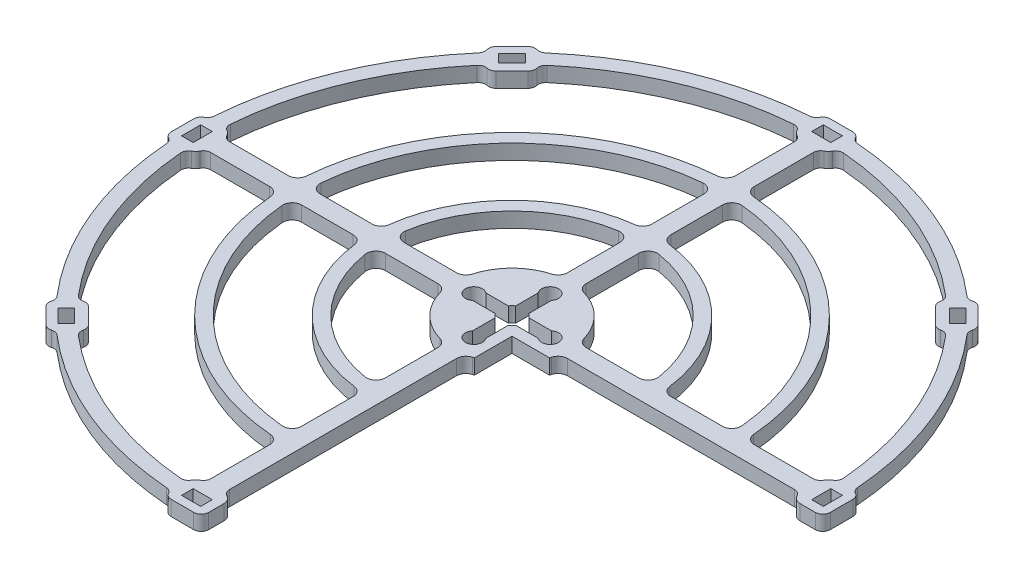
from build123d import *

# Parameters (mm, degrees)
SKETCH1_R             = 15.5
BOSS_EXTRUDE1_DEPTH   = 4
BOSS_EXTRUDE1_2_DEPTH = 4
BOSS_EXTRUDE1_3_DEPTH = 4
BOSS_EXTRUDE1_4_DEPTH = 4
BOSS_EXTRUDE2_DEPTH   = 4
CUT_EXTRUDE1_DEPTH    = 4
BOSS_EXTRUDE5_DEPTH   = 4
SKETCH5_W             = 5.1
SKETCH5_H             = 3.1
SKETCH5_W_2           = 3.1
SKETCH5_H_2           = 5.1
CUT_EXTRUDE3_DEPTH    = 125.309437393
SKETCH6_W             = 10.00423668
SKETCH6_H             = 10.00423668
CUT_EXTRUDE4_DEPTH    = 125.309437393
FILLET1_R             = 2.5
FILLET2_R             = 2


with BuildPart() as part:
    # Sketch1 → Boss-Extrude1 (new body)
    with BuildSketch(Plane(origin=(0, 0, 0), x_dir=(1, 0, 0), z_dir=(0, 1, 0))):
        with Locations(Location((0, 0, 0), (0, 0, 270))):
            Circle(SKETCH1_R)
    extrude(amount=BOSS_EXTRUDE1_DEPTH)



with BuildPart() as body_2:
    # Sketch1 → Boss-Extrude1 2 (new body)
    with BuildSketch(Plane(origin=(0, 0, 0), x_dir=(1, 0, 0), z_dir=(0, 1, 0))):
        with BuildLine():
            Line((2.5, -56.27783262), (2.5, -59.781082106))
            ThreePointArc((2.5, -59.781082106), (-42.308555741, 42.308555741), (59.781082106, -2.5))
            Line((59.781082106, -2.5), (56.27783262, -2.5))
            ThreePointArc((56.27783262, -2.5), (-39.833682007, 39.833682007), (2.5, -56.27783262))
        make_face()
    extrude(amount=BOSS_EXTRUDE1_2_DEPTH)


with BuildPart() as body_3:
    # Sketch1 → Boss-Extrude1 3 (new body)
    with BuildSketch(Plane(origin=(0, 0, 0), x_dir=(1, 0, 0), z_dir=(0, 1, 0))):
        with BuildLine():
            Line((2.5, -34.0750805), (2.5, -37.583610494))
            ThreePointArc((2.5, -37.583610494), (-26.634355425, 26.634355425), (37.583610494, -2.5))
            Line((37.583610494, -2.5), (34.0750805, -2.5))
            ThreePointArc((34.0750805, -2.5), (-24.159481691, 24.159481691), (2.5, -34.0750805))
        make_face()
    extrude(amount=BOSS_EXTRUDE1_3_DEPTH)


with BuildPart() as body_4:
    # Sketch1 → Boss-Extrude1 4 (new body)
    with BuildSketch(Plane(origin=(0, 0, 0), x_dir=(1, 0, 0), z_dir=(0, 1, 0))):
        with BuildLine():
            Line((2.5, -81.961881384), (2.5, -85.963655111))
            ThreePointArc((2.5, -85.963655111), (-60.811183182, 60.811183182), (85.963655111, -2.5))
            Line((85.963655111, -2.5), (81.961881384, -2.5))
            ThreePointArc((81.961881384, -2.5), (-57.982756057, 57.982756057), (2.5, -81.961881384))
        make_face()
    extrude(amount=BOSS_EXTRUDE1_4_DEPTH)


with BuildPart() as part_1:
    add(part.part)

    add(body_2.part)  # Boss-Extrude2 merges body 2

    add(body_3.part)  # Boss-Extrude2 merges body 3

    add(body_4.part)  # Boss-Extrude2 merges body 4
    # Sketch2 → Boss-Extrude2 (add)
    with BuildSketch(Plane(origin=(0, 4, 0), x_dir=(1, 0, 0), z_dir=(0, 1, 0))):
        with BuildLine():
            Line((-2.5, -2.5), (-2.5, 2.5))
            Line((-2.5, 2.5), (-81.961881384, 2.5))
            ThreePointArc((-81.961881384, 2.5), (-82, 0), (-81.961881384, -2.5))
            Line((-81.961881384, -2.5), (-2.5, -2.5))
        make_face()
        with BuildLine():
            ThreePointArc((2.5, 81.961881384), (0, 82), (-2.5, 81.961881384))
            Line((-2.5, 81.961881384), (-2.5, 2.5))
            Line((-2.5, 2.5), (2.5, 2.5))
            Line((2.5, 2.5), (2.5, 81.961881384))
        make_face()
        with BuildLine():
            Line((81.961881384, 2.5), (2.5, 2.5))
            Line((2.5, 2.5), (2.5, -2.5))
            Line((2.5, -2.5), (81.961881384, -2.5))
            ThreePointArc((81.961881384, -2.5), (82, 0), (81.961881384, 2.5))
        make_face()
        with BuildLine():
            Line((2.5, -2.5), (-2.5, -2.5))
            Line((-2.5, -2.5), (-2.5, -81.961881384))
            ThreePointArc((-2.5, -81.961881384), (0, -82), (2.5, -81.961881384))
            Line((2.5, -81.961881384), (2.5, -2.5))
        make_face()
    extrude(amount=-BOSS_EXTRUDE2_DEPTH)

    # Sketch3 → Cut-Extrude1 (cut)
    with BuildSketch(Plane(origin=(0, 4, 0), x_dir=(1, 0, 0), z_dir=(0, 1, 0))):
        with BuildLine():
            Line((2.738612788, 1.75), (8.745786438, 1.75))
            ThreePointArc((8.745786438, 1.75), (12.41, 0), (8.745786438, -1.75))
            Line((8.745786438, -1.75), (2.738612788, -1.75))
            ThreePointArc((2.738612788, -1.75), (2.298097039, -2.298097039), (1.75, -2.738612788))
            Line((1.75, -2.738612788), (1.75, -8.745786438))
            ThreePointArc((1.75, -8.745786438), (0, -12.41), (-1.75, -8.745786438))
            Line((-1.75, -8.745786438), (-1.75, -2.738612788))
            ThreePointArc((-1.75, -2.738612788), (-2.298097039, -2.298097039), (-2.738612788, -1.75))
            Line((-2.738612788, -1.75), (-8.745786438, -1.75))
            ThreePointArc((-8.745786438, -1.75), (-12.41, 0), (-8.745786438, 1.75))
            Line((-8.745786438, 1.75), (-2.738612788, 1.75))
            ThreePointArc((-2.738612788, 1.75), (-2.298097039, 2.298097039), (-1.75, 2.738612788))
            Line((-1.75, 2.738612788), (-1.75, 8.745786438))
            ThreePointArc((-1.75, 8.745786438), (0, 12.41), (1.75, 8.745786438))
            Line((1.75, 8.745786438), (1.75, 2.738612788))
            ThreePointArc((1.75, 2.738612788), (2.298097039, 2.298097039), (2.738612788, 1.75))
        make_face()
    extrude(amount=-CUT_EXTRUDE1_DEPTH, mode=Mode.SUBTRACT)

    # Sketch4 → Boss-Extrude5 (add)
    with BuildSketch(Plane(origin=(0, 4, 0), x_dir=(1, 0, 0), z_dir=(0, 1, 0))):
        with BuildLine():
            Line((-5, 81.847419019), (-5, 85.854528128))
            ThreePointArc((-5, 85.854528128), (-4.414213562, 87.26874169), (-3, 87.854528128))
            Line((-3, 87.854528128), (3, 87.854528128))
            ThreePointArc((3, 87.854528128), (4.414213562, 87.26874169), (5, 85.854528128))
            Line((5, 85.854528128), (5, 81.847419019))
            ThreePointArc((5, 81.847419019), (4.267766953, 80.079652066), (2.5, 79.347419019))
            Line((2.5, 79.347419019), (-2.5, 79.347419019))
            ThreePointArc((-2.5, 79.347419019), (-4.267766953, 80.079652066), (-5, 81.847419019))
        make_face()
        with BuildLine():
            Line((54.339331105, 61.410398917), (57.172785129, 64.24385294))
            ThreePointArc((57.172785129, 64.24385294), (58.584485241, 64.828598273), (59.996185354, 64.24385294))
            Line((59.996185354, 64.24385294), (64.24385294, 59.996185354))
            ThreePointArc((64.24385294, 59.996185354), (64.828598273, 58.584485241), (64.24385294, 57.172785129))
            Line((64.24385294, 57.172785129), (61.410398917, 54.339331105))
            ThreePointArc((61.410398917, 54.339331105), (59.998698804, 53.754585772), (58.586998691, 54.339331105))
            Line((58.586998691, 54.339331105), (54.339331105, 58.586998691))
            ThreePointArc((54.339331105, 58.586998691), (53.754585772, 59.998698804), (54.339331105, 61.410398917))
        make_face()
        with BuildLine():
            Line((81.847419019, 5), (85.854528128, 5))
            ThreePointArc((85.854528128, 5), (87.26874169, 4.414213562), (87.854528128, 3))
            Line((87.854528128, 3), (87.854528128, -3))
            ThreePointArc((87.854528128, -3), (87.26874169, -4.414213562), (85.854528128, -5))
            Line((85.854528128, -5), (81.847419019, -5))
            ThreePointArc((81.847419019, -5), (80.079652066, -4.267766953), (79.347419019, -2.5))
            Line((79.347419019, -2.5), (79.347419019, 2.5))
            ThreePointArc((79.347419019, 2.5), (80.079652066, 4.267766953), (81.847419019, 5))
        make_face()
        with BuildLine():
            Line((5, -81.847419019), (5, -85.854528128))
            ThreePointArc((5, -85.854528128), (4.414213562, -87.26874169), (3, -87.854528128))
            Line((3, -87.854528128), (-3, -87.854528128))
            ThreePointArc((-3, -87.854528128), (-4.414213562, -87.26874169), (-5, -85.854528128))
            Line((-5, -85.854528128), (-5, -81.847419019))
            ThreePointArc((-5, -81.847419019), (-4.267766953, -80.079652066), (-2.5, -79.347419019))
            Line((-2.5, -79.347419019), (2.5, -79.347419019))
            ThreePointArc((2.5, -79.347419019), (4.267766953, -80.079652066), (5, -81.847419019))
        make_face()
        with BuildLine():
            Line((-81.847419019, -5), (-85.854528128, -5))
            ThreePointArc((-85.854528128, -5), (-87.26874169, -4.414213562), (-87.854528128, -3))
            Line((-87.854528128, -3), (-87.854528128, 3))
            ThreePointArc((-87.854528128, 3), (-87.26874169, 4.414213562), (-85.854528128, 5))
            Line((-85.854528128, 5), (-81.847419019, 5))
            ThreePointArc((-81.847419019, 5), (-80.079652066, 4.267766953), (-79.347419019, 2.5))
            Line((-79.347419019, 2.5), (-79.347419019, -2.5))
            ThreePointArc((-79.347419019, -2.5), (-80.079652066, -4.267766953), (-81.847419019, -5))
        make_face()
        with BuildLine():
            Line((-54.339331105, -61.410398917), (-57.172785129, -64.24385294))
            ThreePointArc((-57.172785129, -64.24385294), (-58.584485241, -64.828598273), (-59.996185354, -64.24385294))
            Line((-59.996185354, -64.24385294), (-64.24385294, -59.996185354))
            ThreePointArc((-64.24385294, -59.996185354), (-64.828598273, -58.584485241), (-64.24385294, -57.172785129))
            Line((-64.24385294, -57.172785129), (-61.410398917, -54.339331105))
            ThreePointArc((-61.410398917, -54.339331105), (-59.998698804, -53.754585772), (-58.586998691, -54.339331105))
            Line((-58.586998691, -54.339331105), (-54.339331105, -58.586998691))
            ThreePointArc((-54.339331105, -58.586998691), (-53.754585772, -59.998698804), (-54.339331105, -61.410398917))
        make_face()
        with BuildLine():
            Line((-61.410398917, 54.339331105), (-64.24385294, 57.172785129))
            ThreePointArc((-64.24385294, 57.172785129), (-64.828598273, 58.584485241), (-64.24385294, 59.996185354))
            Line((-64.24385294, 59.996185354), (-59.996185354, 64.24385294))
            ThreePointArc((-59.996185354, 64.24385294), (-58.584485241, 64.828598273), (-57.172785129, 64.24385294))
            Line((-57.172785129, 64.24385294), (-54.339331105, 61.410398917))
            ThreePointArc((-54.339331105, 61.410398917), (-53.754585772, 59.998698804), (-54.339331105, 58.586998691))
            Line((-54.339331105, 58.586998691), (-58.586998691, 54.339331105))
            ThreePointArc((-58.586998691, 54.339331105), (-59.998698804, 53.754585772), (-61.410398917, 54.339331105))
        make_face()
    extrude(amount=-BOSS_EXTRUDE5_DEPTH)

    # Sketch5 → Cut-Extrude3 (cut, through all)
    with BuildSketch(Plane(origin=(0, 4, 0), x_dir=(1, 0, 0), z_dir=(0, 1, 0))):
        with Locations((0, -84)):
            Rectangle(SKETCH5_W, SKETCH5_H)
        Polygon((-60.104076401, -56.497831817), (-62.296107423, -58.689862838), (-58.689862838, -62.296107423), (-56.497831817, -60.104076401), align=None)
        with Locations((-84, 0)):
            Rectangle(SKETCH5_W_2, SKETCH5_H_2)
        Polygon((-56.497831817, 60.104076401), (-58.689862838, 62.296107423), (-62.296107423, 58.689862838), (-60.104076401, 56.497831817), align=None)
        with Locations((0, 84)):
            Rectangle(SKETCH5_W, SKETCH5_H)
        Polygon((60.104076401, 56.497831817), (62.296107423, 58.689862838), (58.689862838, 62.296107423), (56.497831817, 60.104076401), align=None)
        with Locations((84, 0)):
            Rectangle(SKETCH5_W_2, SKETCH5_H_2)
    extrude(amount=-CUT_EXTRUDE3_DEPTH, mode=Mode.SUBTRACT)

    # Sketch6 → Cut-Extrude4 (cut, through all)
    with BuildSketch(Plane(origin=(0, 4, 0), x_dir=(1, 0, 0), z_dir=(0, 1, 0))):
        with Locations((9.75211834, -9.75211834)):
            Rectangle(SKETCH6_W, SKETCH6_H)
    extrude(amount=-CUT_EXTRUDE4_DEPTH, mode=Mode.SUBTRACT)

    # Fillet1
    fillet1_edges = [part_1.edges().sort_by_distance(p)[0] for p in [
        (2.5, 2, -37.583610494),
        (2.5, 2, -34.0750805),
        (2.5, 2, -15.297058541),
        (2.5, 2, -59.781082106),
        (-2.5, 2, -37.583610494),
        (-2.5, 2, -34.0750805),
        (-2.5, 2, -15.297058541),
        (-2.5, 2, -59.781082106),
        (15.297058541, 2, 2.5),
        (37.583610494, 2, -2.5),
        (34.0750805, 2, -2.5),
        (15.297058541, 2, -2.5),
        (59.781082106, 2, -2.5),
        (56.27783262, 2, -2.5),
        (-2.5, 2, 59.781082106),
        (-2.5, 2, 15.297058541),
        (-2.5, 2, 34.0750805),
        (-2.5, 2, 37.583610494),
        (-2.5, 2, 56.27783262),
        (2.5, 2, 15.297058541),
        (-37.583610494, 2, -2.5),
        (-34.0750805, 2, -2.5),
        (-34.0750805, 2, 2.5),
        (-37.583610494, 2, 2.5),
        (-15.297058541, 2, 2.5),
        (-15.297058541, 2, -2.5),
        (-56.27783262, 2, 2.5),
        (-56.27783262, 2, -2.5),
        (-59.781082106, 2, 2.5),
        (-59.781082106, 2, -2.5),
        (-2.5, 2, -56.27783262),
        (2.5, 2, -56.27783262),
    ]]
    fillet(fillet1_edges, radius=FILLET1_R)

    # Fillet2
    fillet2_edges = [part_1.edges().sort_by_distance(p)[0] for p in [
        (-2.5, 2, -79.347419019),
        (-5, 2, -81.847419019),
        (-5, 2, -85.854528128),
        (5, 2, -85.854528128),
        (5, 2, -81.847419019),
        (2.5, 2, -79.347419019),
        (54.339331105, 2, -61.410398917),
        (57.172785129, 2, -64.24385294),
        (64.24385294, 2, -57.172785129),
        (61.410398917, 2, -54.339331105),
        (79.347419019, 2, -2.5),
        (81.847419019, 2, -5),
        (85.854528128, 2, -5),
        (79.347419019, 2, 2.5),
        (2.5, 2, 79.347419019),
        (-5, 2, 85.854528128),
        (-5, 2, 81.847419019),
        (-2.5, 2, 79.347419019),
        (-79.347419019, 2, 2.5),
        (-81.847419019, 2, 5),
        (-85.854528128, 2, 5),
        (-85.854528128, 2, -5),
        (-81.847419019, 2, -5),
        (-79.347419019, 2, -2.5),
        (-54.339331105, 2, 61.410398917),
        (-57.172785129, 2, 64.24385294),
        (-64.24385294, 2, 57.172785129),
        (-61.410398917, 2, 54.339331105),
        (-61.410398917, 2, -54.339331105),
        (-64.24385294, 2, -57.172785129),
        (-57.172785129, 2, -64.24385294),
        (-54.339331105, 2, -61.410398917),
    ]]
    fillet(fillet2_edges, radius=FILLET2_R)


solid = part_1.part
